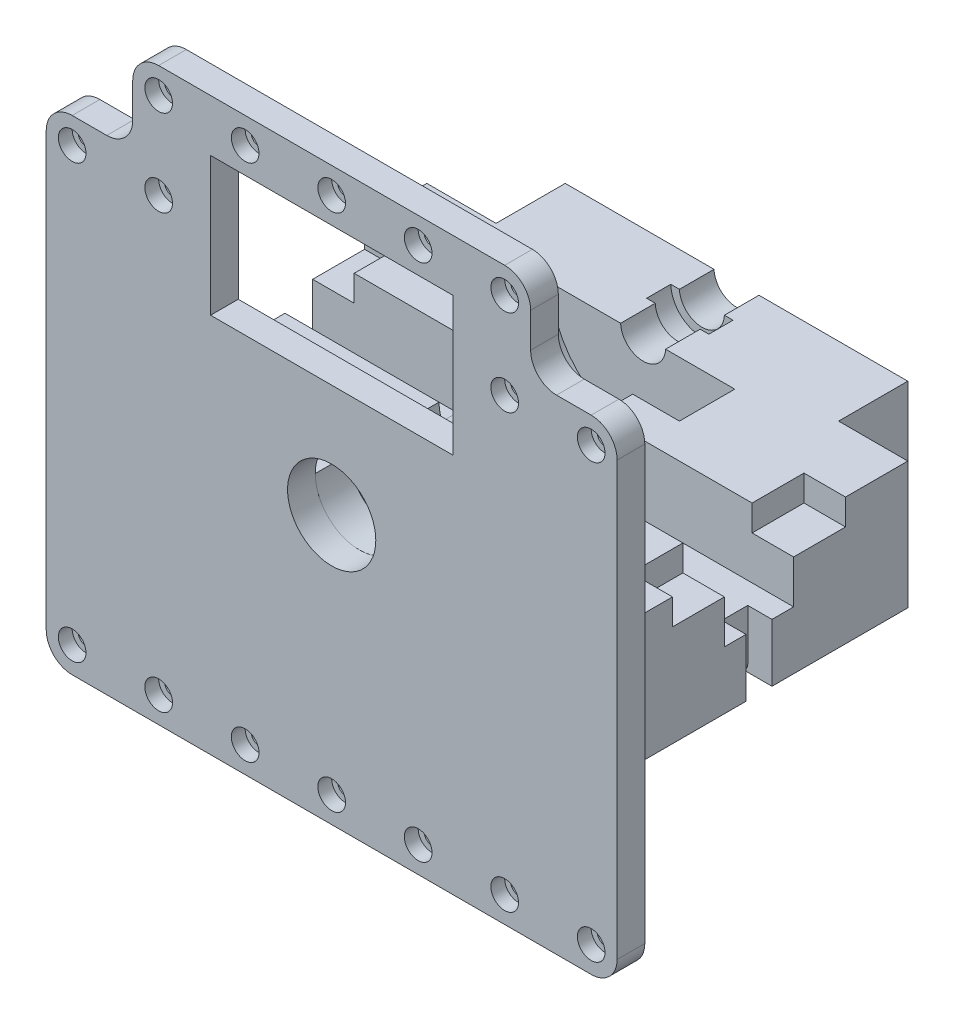
from build123d import *

# Parameters (mm, degrees)
BOSS_EXTRUDE1_DEPTH            = 8
SKETCH3_R                      = 12.75
CUT_EXTRUDE1_DEPTH             = 8
SKETCH5_W                      = 139
SKETCH5_H                      = 67
BOSS_EXTRUDE2_DEPTH            = 109
CUT_EXTRUDE2_START             = 10
SKETCH6_R                      = 26.5
CUT_EXTRUDE2_DEPTH             = 16
CUT_EXTRUDE3_REACH             = 169.909
SKETCH7_R                      = 6.5
CUT_EXTRUDE4_REACH             = 169.909
SKETCH10_W                     = 139
SKETCH10_H                     = 0.25
CUT_EXTRUDE8_START             = 36
SKETCH15_R                     = 32.5
CUT_EXTRUDE8_DEPTH             = 20
CUT_EXTRUDE9_DEPTH             = 216.172605134
CUT_EXTRUDE9_DEPTH_BACK        = 216.172605134
SKETCH16_W                     = 20
SKETCH16_H                     = 20
CUT_EXTRUDE10_START            = 56
SKETCH17_R                     = 26.5
CUT_EXTRUDE10_DEPTH            = 26
BOSS_EXTRUDE6_START            = 56
SKETCH20_W                     = 139
SKETCH20_H                     = 66.75
BOSS_EXTRUDE6_DEPTH            = 10
CUT_EXTRUDE12_REACH            = 169.909
SKETCH21_R                     = 13
FILLET1_R                      = 5
FILLET2_R                      = 5
CUT_EXTRUDE13_DEPTH            = 168.909201654
CUT_EXTRUDE13_DEPTH_BACK       = 17
CUT_EXTRUDE13_START            = 109
SKETCH22_R                     = 9
BOSS_EXTRUDE7_DEPTH            = 10
SKETCH24_W                     = 30
SKETCH24_H                     = 30
CUT_EXTRUDE14_DEPTH            = 109
CUT_EXTRUDE15_DEPTH            = 196.139052985
CUT_EXTRUDE15_DEPTH_BACK       = 196.139052985
SKETCH25_W                     = 30
SKETCH25_H                     = 30
SKETCH25_W_2                   = 43
CUT_EXTRUDE16_DEPTH            = 216.172605134
CUT_EXTRUDE16_DEPTH_BACK       = 12
SKETCH29_W                     = 15
SKETCH29_H                     = 7.5
SKETCH30_W                     = 15
SKETCH30_H                     = 7.5
CUT_EXTRUDE17_DEPTH            = 12
SKETCH31_W                     = 7.5
SKETCH31_H                     = 16.75
CUT_EXTRUDE18_DEPTH            = 7
SKETCH32_W                     = 7.5
SKETCH32_H                     = 16.75
CUT_EXTRUDE19_DEPTH            = 7
SKETCH38_W                     = 20
SKETCH38_H                     = 20
CUT_EXTRUDE20_DEPTH            = 168.914598829
FILLET3_R                      = 2
FILLET4_R                      = 2
SKETCH39_W                     = 79
SKETCH39_H                     = 5.5
CUT_EXTRUDE21_DEPTH            = 36
CBORE_FOR_M4_SHCS1_D           = 4.5
CBORE_FOR_M4_SHCS1_CBORE_D     = 8
CBORE_FOR_M4_SHCS1_CBORE_DEPTH = 4
CUT_EXTRUDE22_DEPTH            = 174.20941083
CUT_EXTRUDE22_DEPTH_BACK       = 174.20941083
SKETCH43_W                     = 70
SKETCH43_H                     = 40


with BuildPart() as part:
    # Sketch2 → Boss-Extrude1 (new body)
    with BuildSketch(Plane.XY):
        with BuildLine():
            Line((-57.5, 60), (-57.5, 50))
            ThreePointArc((-57.5, 50), (-59.696699141, 44.696699141), (-65, 42.5))
            Line((-65, 42.5), (-75, 42.5))
            ThreePointArc((-75, 42.5), (-80.303300859, 40.303300859), (-82.5, 35))
            Line((-82.5, 35), (-82.5, -90))
            ThreePointArc((-82.5, -90), (-80.303300859, -95.303300859), (-75, -97.5))
            Line((-75, -97.5), (75, -97.5))
            ThreePointArc((75, -97.5), (80.303300859, -95.303300859), (82.5, -90))
            Line((82.5, -90), (82.5, 35))
            ThreePointArc((82.5, 35), (80.303300859, 40.303300859), (75, 42.5))
            Line((75, 42.5), (65, 42.5))
            ThreePointArc((65, 42.5), (59.696699141, 44.696699141), (57.5, 50))
            Line((57.5, 50), (57.5, 60))
            ThreePointArc((57.5, 60), (55.303300859, 65.303300859), (50, 67.5))
            Line((50, 67.5), (-50, 67.5))
            ThreePointArc((-50, 67.5), (-55.303300859, 65.303300859), (-57.5, 60))
        make_face()
    extrude(amount=-BOSS_EXTRUDE1_DEPTH)

    # Sketch3 → Cut-Extrude1 (cut)
    with BuildSketch(Plane.XY):
        with Locations((0, -20)):
            Circle(SKETCH3_R)
    extrude(amount=-CUT_EXTRUDE1_DEPTH, mode=Mode.SUBTRACT)

    # Sketch5 → Boss-Extrude2 (add)
    with BuildSketch(Plane(origin=(0, 0, -8), x_dir=(-1, 0, 0), z_dir=(0, 0, -1))):
        with Locations((0, -53.5)):
            Rectangle(SKETCH5_W, SKETCH5_H)
    extrude(amount=BOSS_EXTRUDE2_DEPTH)

    # Sketch6 → Cut-Extrude2 (cut)
    with BuildSketch(Plane(origin=(0, 0, -8), x_dir=(-1, 0, 0), z_dir=(0, 0, -1)).offset(CUT_EXTRUDE2_START)):
        with Locations((0, -20)):
            Circle(SKETCH6_R)
    extrude(amount=CUT_EXTRUDE2_DEPTH, mode=Mode.SUBTRACT)

    # Cut-Extrude3: up to this face of the body (flat: up to its plane)
    cut_extrude3_end = Plane(part.part.faces().sort_by_distance((0, -53.5, -117))[0])
    # Sketch7 → Cut-Extrude3 (cut, up to the picked face)
    with BuildSketch(Plane(origin=(0, 0, -8), x_dir=(-1, 0, 0), z_dir=(0, 0, -1)), mode=Mode.PRIVATE) as cut_extrude3_sk1:
        with Locations((0, -20)):
            Circle(SKETCH7_R)
    cut_extrude3_tool1 = split(extrude(cut_extrude3_sk1.sketch, amount=CUT_EXTRUDE3_REACH, mode=Mode.PRIVATE), bisect_by=cut_extrude3_end, keep=Keep.BOTH, mode=Mode.PRIVATE)
    add(cut_extrude3_tool1.solids().sort_by(Axis((0, -20, -8), (0, 0, -1)))[0], mode=Mode.SUBTRACT)

    # Cut-Extrude4: up to this face of the body (flat: up to its plane)
    cut_extrude4_end = Plane(part.part.faces().sort_by_distance((0, -53.720640565, -117))[0])
    # Sketch10 → Cut-Extrude4 (cut, up to the picked face)
    with BuildSketch(Plane(origin=(0, 0, -8), x_dir=(-1, 0, 0), z_dir=(0, 0, -1)), mode=Mode.PRIVATE) as cut_extrude4_sk1:
        with Locations((0, -20.125)):
            Rectangle(SKETCH10_W, SKETCH10_H)
    cut_extrude4_tool1 = split(extrude(cut_extrude4_sk1.sketch, amount=CUT_EXTRUDE4_REACH, mode=Mode.PRIVATE), bisect_by=cut_extrude4_end, keep=Keep.BOTH, mode=Mode.PRIVATE)
    add(cut_extrude4_tool1.solids().sort_by(Axis((0, -20.125, -8), (0, 0, -1)))[0], mode=Mode.SUBTRACT)

    # Sketch15 → Cut-Extrude8 (cut)
    with BuildSketch(Plane(origin=(0, 0, -8), x_dir=(-1, 0, 0), z_dir=(0, 0, -1)).offset(CUT_EXTRUDE8_START)):
        with Locations((0, -20)):
            Circle(SKETCH15_R)
    extrude(amount=CUT_EXTRUDE8_DEPTH, mode=Mode.SUBTRACT)

    # Sketch16 → Cut-Extrude9 (cut, two sides: drawn at the far end of the back side and taken through both)
    with BuildSketch(Plane(origin=(69.5, 0, 0), x_dir=(0, 0, -1), z_dir=(1, 0, 0)).offset(-CUT_EXTRUDE9_DEPTH_BACK)):
        with Locations((54, -30.25)):
            Rectangle(SKETCH16_W, SKETCH16_H)
    extrude(amount=CUT_EXTRUDE9_DEPTH + CUT_EXTRUDE9_DEPTH_BACK, mode=Mode.SUBTRACT)

    # Sketch17 → Cut-Extrude10 (cut)
    with BuildSketch(Plane(origin=(0, 0, -8), x_dir=(-1, 0, 0), z_dir=(0, 0, -1)).offset(CUT_EXTRUDE10_START)):
        with Locations((0, -20)):
            Circle(SKETCH17_R)
    extrude(amount=CUT_EXTRUDE10_DEPTH, mode=Mode.SUBTRACT)

    # Sketch20 → Boss-Extrude6 (add)
    with BuildSketch(Plane(origin=(0, 0, -8), x_dir=(-1, 0, 0), z_dir=(0, 0, -1)).offset(BOSS_EXTRUDE6_START)):
        with Locations((0, -53.625)):
            Rectangle(SKETCH20_W, SKETCH20_H)
    extrude(amount=BOSS_EXTRUDE6_DEPTH)

    # Cut-Extrude12: up to this face of the body (flat: up to its plane)
    cut_extrude12_end = Plane(part.part.faces().sort_by_distance((0, -31.382164936, -74))[0])
    # Sketch21 → Cut-Extrude12 (cut, up to the picked face)
    with BuildSketch(Plane(origin=(0, 0, -8), x_dir=(-1, 0, 0), z_dir=(0, 0, -1)), mode=Mode.PRIVATE) as cut_extrude12_sk1:
        with Locations((0, -20)):
            Circle(SKETCH21_R)
    cut_extrude12_tool1 = split(extrude(cut_extrude12_sk1.sketch, amount=CUT_EXTRUDE12_REACH, mode=Mode.PRIVATE), bisect_by=cut_extrude12_end, keep=Keep.BOTH, mode=Mode.PRIVATE)
    add(cut_extrude12_tool1.solids().sort_by(Axis((0, -20, -8), (0, 0, -1)))[0], mode=Mode.SUBTRACT)

    # Fillet1
    fillet1_edges = [part.edges().sort_by_distance(p)[0] for p in [
        (25.420218331, -40.25, -54),
    ]]
    fillet(fillet1_edges, radius=FILLET1_R)

    # Fillet2
    fillet2_edges = [part.edges().sort_by_distance(p)[0] for p in [
        (-25.420218331, -40.25, -54),
    ]]
    fillet(fillet2_edges, radius=FILLET2_R)

    # Sketch22 → Cut-Extrude13 (cut, two sides: drawn at the far end of the back side and taken through both)
    with BuildSketch(Plane(origin=(0, 0, -8), x_dir=(-1, 0, 0), z_dir=(0, 0, -1)).offset(CUT_EXTRUDE13_START - CUT_EXTRUDE13_DEPTH_BACK)):
        with Locations((0, -20)):
            Circle(SKETCH22_R)
    extrude(amount=CUT_EXTRUDE13_DEPTH + CUT_EXTRUDE13_DEPTH_BACK, mode=Mode.SUBTRACT)

    # Sketch23 → Boss-Extrude7 (add)
    with BuildSketch(Plane(origin=(0, 0, -117), x_dir=(-1, 0, 0), z_dir=(0, 0, -1))):
        with BuildLine():
            Line((-8.996527108, -20.25), (-6.495190528, -20.25))
            ThreePointArc((-6.495190528, -20.25), (0, -26.5), (6.495190528, -20.25))
            Line((6.495190528, -20.25), (8.996527108, -20.25))
            ThreePointArc((8.996527108, -20.25), (0, -29), (-8.996527108, -20.25))
        make_face()
    extrude(amount=-BOSS_EXTRUDE7_DEPTH)

    # Sketch24 → Cut-Extrude14 (cut)
    with BuildSketch(Plane(origin=(0, 0, -117), x_dir=(-1, 0, 0), z_dir=(0, 0, -1))):
        with Locations((-54.5, -72)):
            Rectangle(SKETCH24_W, SKETCH24_H)
        with Locations((54.5, -72)):
            Rectangle(SKETCH24_W, SKETCH24_H)
    extrude(amount=-CUT_EXTRUDE14_DEPTH, mode=Mode.SUBTRACT)

    # Sketch25 → Cut-Extrude15 (cut, two sides: drawn at the far end of the back side and taken through both)
    with BuildSketch(Plane(origin=(39.5, 0, 0), x_dir=(0, 0, -1), z_dir=(1, 0, 0)).offset(-CUT_EXTRUDE15_DEPTH_BACK)):
        with Locations((23, -72)):
            Rectangle(SKETCH25_W, SKETCH25_H)
        with Locations((95.5, -72)):
            Rectangle(SKETCH25_W_2, SKETCH25_H)
    extrude(amount=CUT_EXTRUDE15_DEPTH + CUT_EXTRUDE15_DEPTH_BACK, mode=Mode.SUBTRACT)

    # Sketch29 → Cut-Extrude16 (cut, two sides: drawn at the far end of the back side and taken through both)
    with BuildSketch(Plane(origin=(69.5, 0, 0), x_dir=(0, 0, -1), z_dir=(1, 0, 0)).offset(-CUT_EXTRUDE16_DEPTH_BACK)):
        with Locations((36.5, -24)):
            Rectangle(SKETCH29_W, SKETCH29_H)
        with Locations((71.5, -24)):
            Rectangle(SKETCH29_W, SKETCH29_H)
    extrude(amount=CUT_EXTRUDE16_DEPTH + CUT_EXTRUDE16_DEPTH_BACK, mode=Mode.SUBTRACT)

    # Sketch30 → Cut-Extrude17 (cut)
    with BuildSketch(Plane.ZY.offset(69.5)):
        with Locations((-36.5, -24)):
            Rectangle(SKETCH30_W, SKETCH30_H)
        with Locations((-71.5, -24)):
            Rectangle(SKETCH30_W, SKETCH30_H)
    extrude(amount=-CUT_EXTRUDE17_DEPTH, mode=Mode.SUBTRACT)

    # Sketch31 → Cut-Extrude18 (cut)
    with BuildSketch(Plane.ZY.offset(69.5)):
        with Locations((-54, -48.625)):
            Rectangle(SKETCH31_W, SKETCH31_H)
    extrude(amount=-CUT_EXTRUDE18_DEPTH, mode=Mode.SUBTRACT)

    # Sketch32 → Cut-Extrude19 (cut)
    with BuildSketch(Plane(origin=(69.5, 0, 0), x_dir=(0, 0, -1), z_dir=(1, 0, 0))):
        with Locations((54, -48.625)):
            Rectangle(SKETCH32_W, SKETCH32_H)
    extrude(amount=-CUT_EXTRUDE19_DEPTH, mode=Mode.SUBTRACT)

    # Sketch38 → Cut-Extrude20 (cut, through all)
    with BuildSketch(Plane(origin=(0, -20.25, 0), x_dir=(1, 0, 0), z_dir=(0, 1, 0))):
        with Locations((59.5, 107)):
            Rectangle(SKETCH38_W, SKETCH38_H)
        with Locations((-59.5, 107)):
            Rectangle(SKETCH38_W, SKETCH38_H)
    extrude(amount=-CUT_EXTRUDE20_DEPTH, mode=Mode.SUBTRACT)

    # Fillet3
    fillet3_edges = [part.edges().sort_by_distance(p)[0] for p in [
        (62.5, -57, -54),
    ]]
    fillet(fillet3_edges, radius=FILLET3_R)

    # Fillet4
    fillet4_edges = [part.edges().sort_by_distance(p)[0] for p in [
        (-62.5, -57, -54),
    ]]
    fillet(fillet4_edges, radius=FILLET4_R)

    # Sketch39 → Cut-Extrude21 (cut)
    with BuildSketch(Plane(origin=(0, 0, -74), x_dir=(-1, 0, 0), z_dir=(0, 0, -1))):
        with Locations((0, -84.25)):
            Rectangle(SKETCH39_W, SKETCH39_H)
    extrude(amount=-CUT_EXTRUDE21_DEPTH, mode=Mode.SUBTRACT)

    # CBORE for M4 SHCS1 (through all)
    with Locations(Plane.XY):
        with Locations((-75, 35), (-50, 35), (-50, 60), (-25, 60), (0, 60), (25, 60), (50, 60), (50, 35), (75, 35), (-75, -90), (-50, -90), (-25, -90), (0, -90), (25, -90), (50, -90), (75, -90)):
            CounterBoreHole(CBORE_FOR_M4_SHCS1_D / 2, CBORE_FOR_M4_SHCS1_CBORE_D / 2, CBORE_FOR_M4_SHCS1_CBORE_DEPTH)

    # Sketch43 → Cut-Extrude22 (cut, two sides: drawn at the far end of the back side and taken through both)
    with BuildSketch(Plane.XY.offset(-CUT_EXTRUDE22_DEPTH_BACK)):
        with Locations((0, 32.5)):
            Rectangle(SKETCH43_W, SKETCH43_H)
    extrude(amount=CUT_EXTRUDE22_DEPTH + CUT_EXTRUDE22_DEPTH_BACK, mode=Mode.SUBTRACT)


solid = part.part
